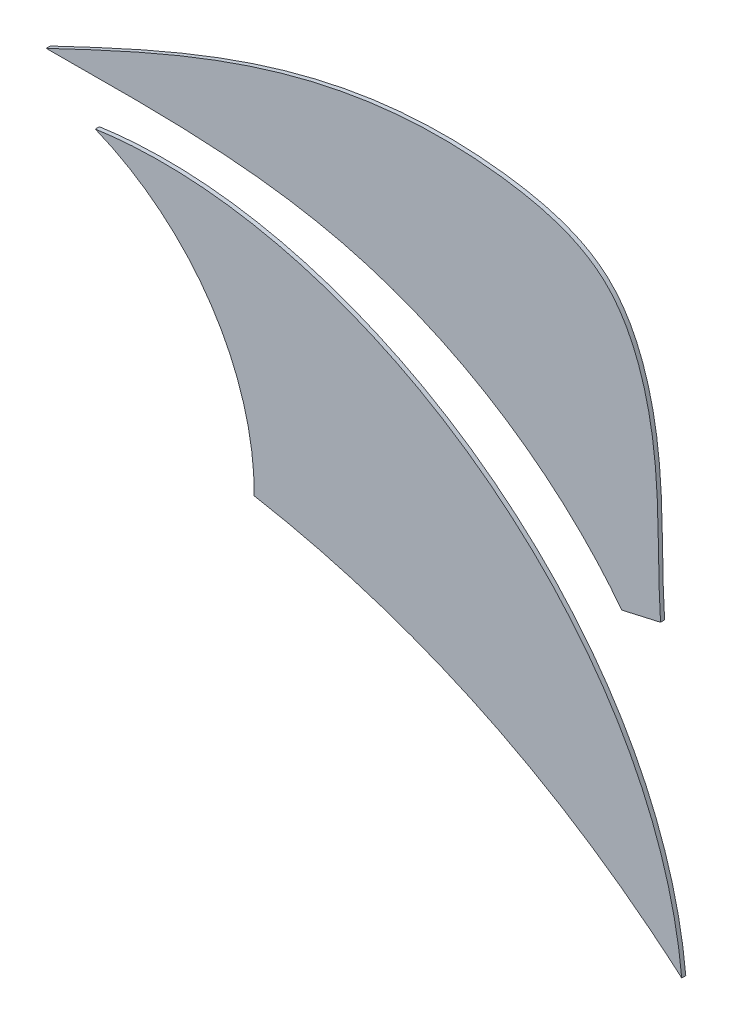
from build123d import *

# Parameters (mm, degrees)
EXTRUDE_1_DEPTH   = 0.6
EXTRUDE_1_2_DEPTH = 0.6


with BuildPart() as part:
    # 草图1 → 凸台-拉伸1 (new body)
    with BuildSketch(Plane.XY):
        with BuildLine():
            Line((-21.430428591, 56.075265565), (-15.732435604, 57.372536979))
            add(Edge.make_bspline(
                [(-15.732435604, 57.372536979), (-16.352874844, 66.617684038), (-15.094128925, 80.14081547), (-23.052895127, 99.154839521), (-58.218524544, 108.015164997), (-85.408309672, 95.303557212), (-106.280242174, 85.360474504)],
                knots=[0, 0, 0, 0, 0.217981109, 0.320733404, 0.44968682, 1, 1, 1, 1], degree=3))
            add(Edge.make_bspline(
                [(-106.280242174, 85.360474504), (-91.185245566, 85.415567905), (-59.053058909, 86.36016946), (-31.088236286, 68.673203369), (-21.430428591, 56.075265565)],
                knots=[0, 0, 0, 0, 0.491735089, 1, 1, 1, 1], degree=3))
        make_face()
    extrude(amount=EXTRUDE_1_DEPTH)


with BuildPart() as body_2:
    # 草图1 → Extrude 1 2 (new body)
    with BuildSketch(Plane.XY):
        with BuildLine():
            ThreePointArc((-75.615874929, 43.570118882), (-81.930733792, 64.724394407), (-99.038309587, 78.678306615))
            add(Edge.make_bspline(
                [(-12.604061511, 13.528549047), (-16.576330828, 54.663156355), (-59.476193489, 84.373919061), (-99.038309587, 78.678306615)],
                knots=[0, 0, 0, 0, 1, 1, 1, 1], degree=3))
            add(Edge.make_bspline(
                [(-75.615874929, 43.570118882), (-39.87136374, 37.161531029), (-12.604061511, 13.528549047)],
                knots=[0, 0, 0, 1, 1, 1], degree=2))
        make_face()
    extrude(amount=EXTRUDE_1_2_DEPTH)


solid = Compound([part.part, body_2.part])
